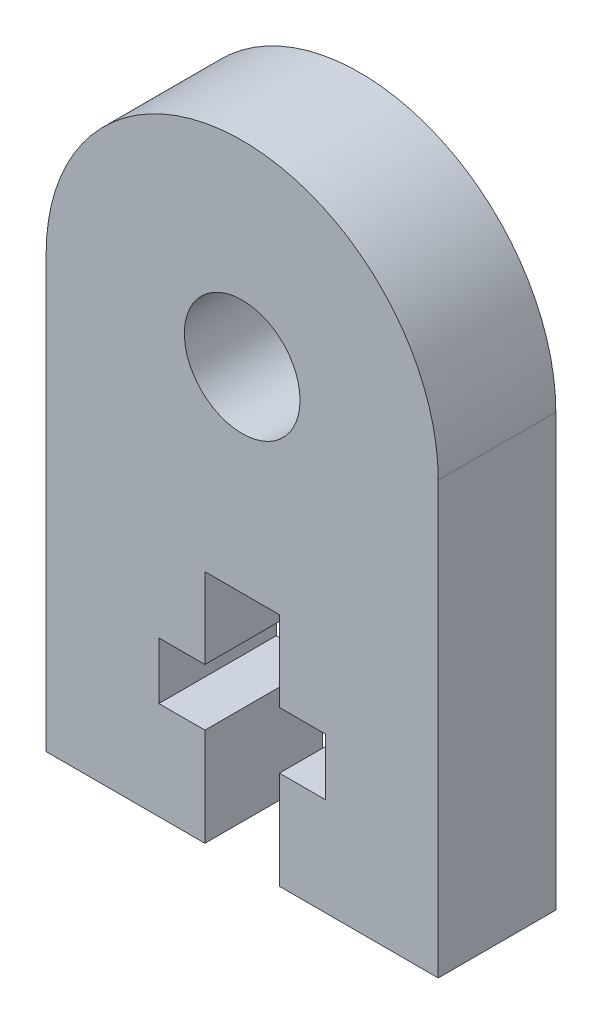
from build123d import *

# Parameters (mm, degrees)
SKETCH1_R           = 2.95
BOSS_EXTRUDE1_DEPTH = 6
CUT_EXTRUDE2_DEPTH  = 25.899799196


with BuildPart() as part:
    # Sketch1 → Boss-Extrude1 (new body)
    with BuildSketch(Plane.XY):
        with BuildLine():
            Line((-10, 0), (-10, -22))
            Line((-10, -22), (10, -22))
            Line((10, -22), (10, 0))
            ThreePointArc((10, 0), (0, 10), (-10, 0))
        make_face()
        Circle(SKETCH1_R, mode=Mode.SUBTRACT)
    extrude(amount=BOSS_EXTRUDE1_DEPTH)

    # Sketch3 → Cut-Extrude2 (cut, through all)
    with BuildSketch(Plane.XY.offset(6)):
        Polygon((-1.9, -22), (1.9, -22), (1.9, -17), (4.25, -17), (4.25, -14.1), (1.9, -14.1), (1.9, -10), (-1.9, -10), (-1.9, -14.1), (-4.25, -14.1), (-4.25, -17), (-1.9, -17), align=None)
    extrude(amount=-CUT_EXTRUDE2_DEPTH, mode=Mode.SUBTRACT)


solid = part.part
